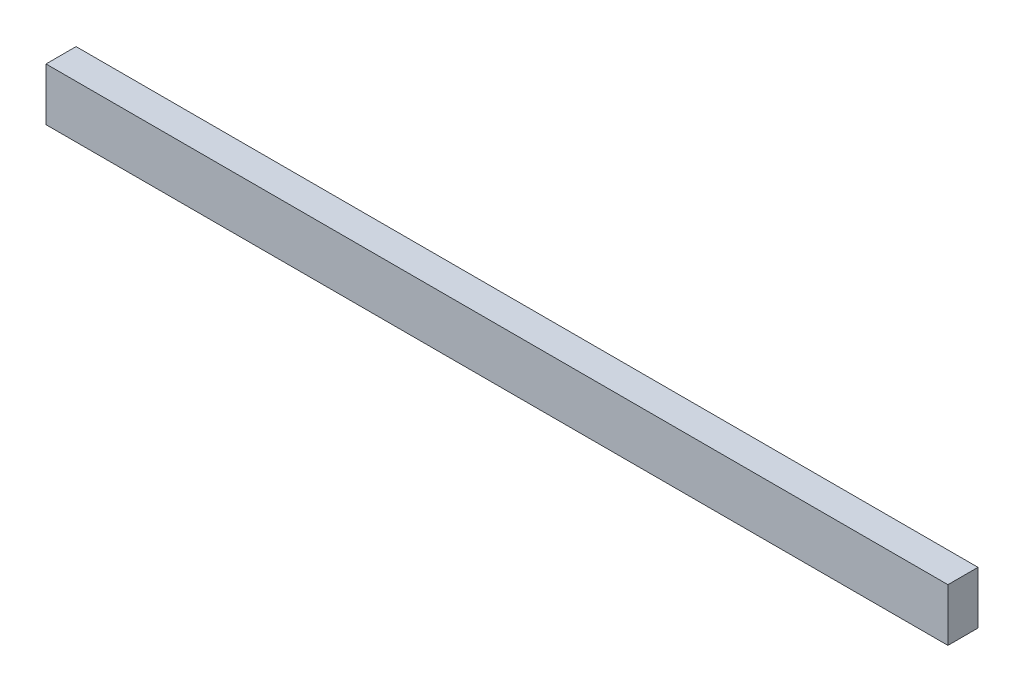
from build123d import *

# Parameters (mm, degrees)
SKETCH1_W           = 304.8
SKETCH1_H           = 17.78
BOSS_EXTRUDE1_DEPTH = 10.16


with BuildPart() as part:
    # Sketch1 → Boss-Extrude1 (new body)
    with BuildSketch(Plane.XY):
        with Locations((-103.554852369, 93.712241965)):
            Rectangle(SKETCH1_W, SKETCH1_H)
    extrude(amount=BOSS_EXTRUDE1_DEPTH)


solid = part.part
